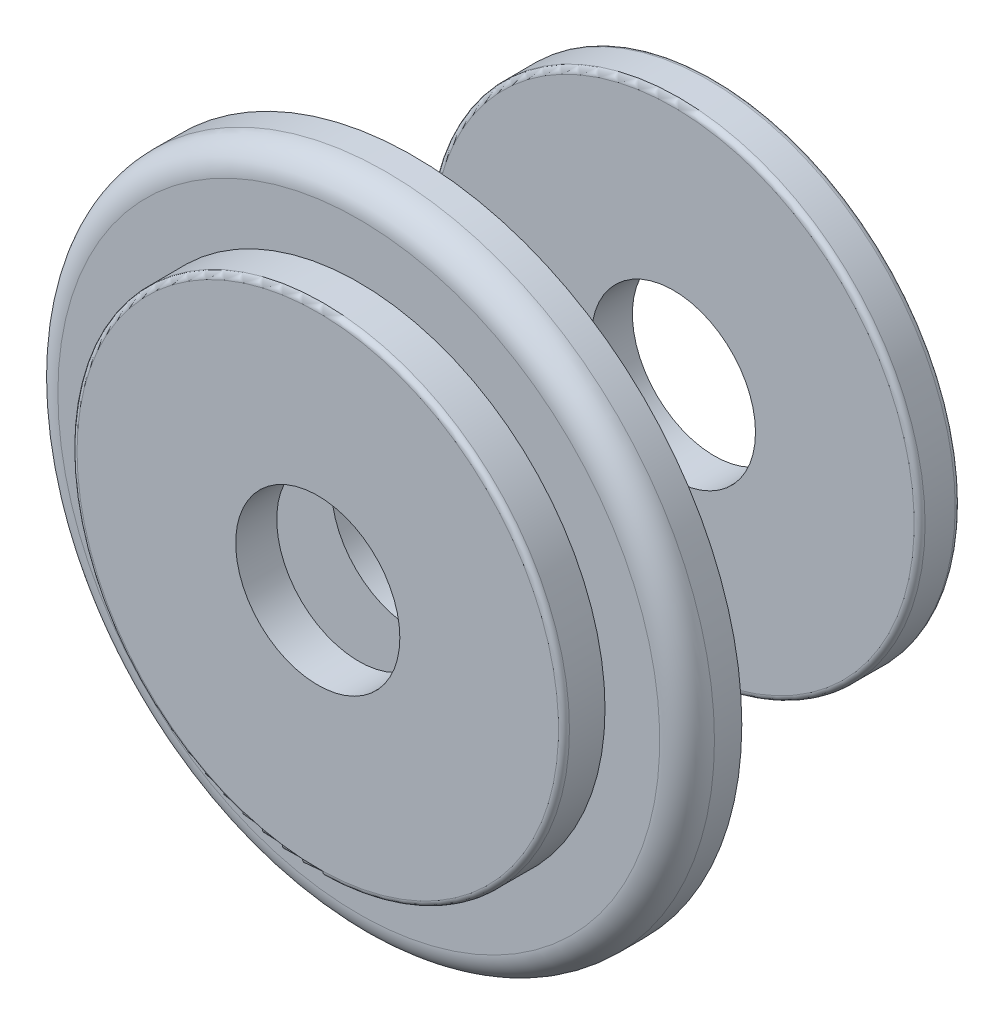
from build123d import *

# Parameters (mm, degrees)
ESQUISSE1_W = 0.75
ESQUISSE1_H = 3
CONG_1_R    = 0.5
CONG_2_R    = 0.1
CONG_3_R    = 0.1


with BuildPart() as part:
    # Esquisse1 → Révolution1 (revolve)
    with BuildSketch(Plane(origin=(0, 0, 0), x_dir=(0, 0, -1), z_dir=(1, 0, 0)), mode=Mode.PRIVATE) as r_volution1_sk:
        Polygon((0, 1.5), (-0.75, 1.5), (-0.75, 3), (-1.75, 3), (-1.75, 1.5), (-2.5, 1.5), (-2.5, 4.5), (-1.75, 4.5), (-1.75, 6), (-0.75, 6), (-0.75, 4.5), (0, 4.5), align=None)
        with Locations((4.375, 3)):
            Rectangle(ESQUISSE1_W, ESQUISSE1_H)
    revolve(r_volution1_sk.sketch.rotate(Axis((0, 0, 20.5), (0, 0, -1)), 90), axis=Axis((0, 0, 20.5), (0, 0, -1)))

    # Congé1
    cong_1_edges = [part.edges().sort_by_distance(p)[0] for p in [
        (-6, 0, 1.75),
    ]]
    fillet(cong_1_edges, radius=CONG_1_R)

    # Congé2
    cong_2_edges = [part.edges().sort_by_distance(p)[0] for p in [
        (-4.5, 0, 2.5),
        (-4.5, 0, 0),
    ]]
    fillet(cong_2_edges, radius=CONG_2_R)

    # Congé3
    cong_3_edges = [part.edges().sort_by_distance(p)[0] for p in [
        (-4.5, 0, -4.75),
        (-4.5, 0, -4),
    ]]
    fillet(cong_3_edges, radius=CONG_3_R)


solid = part.part
